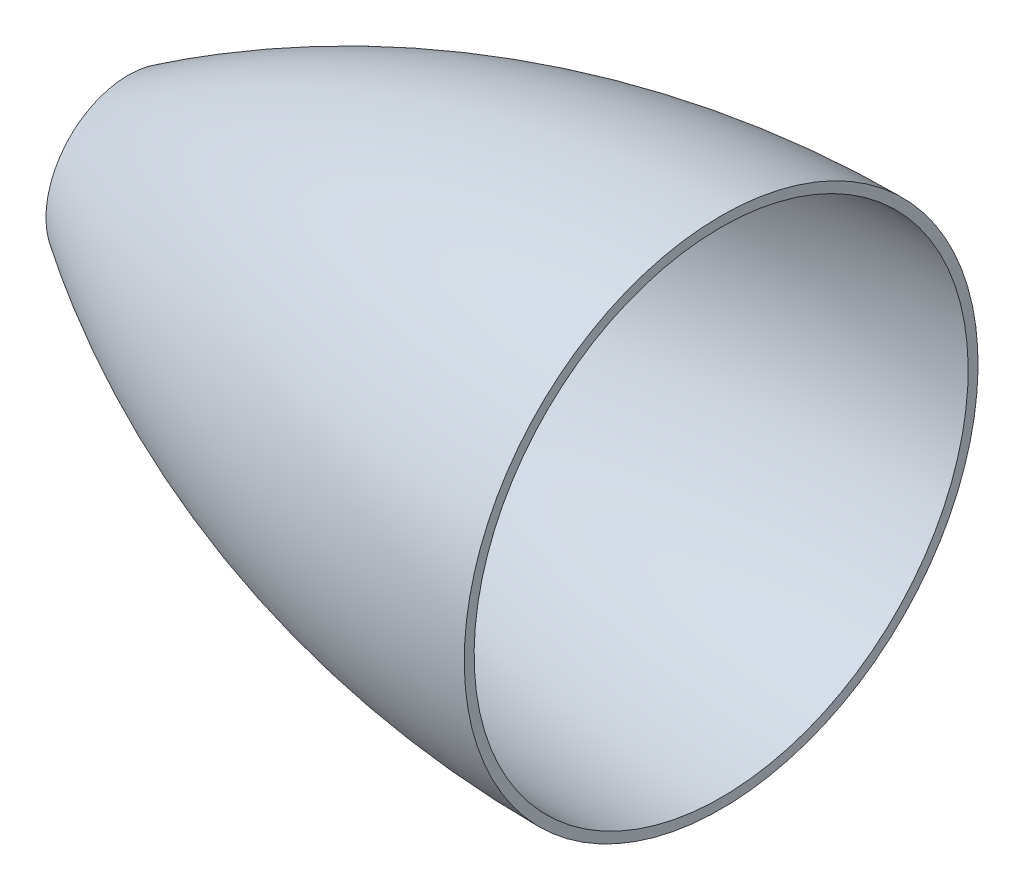
from build123d import *


with BuildPart() as part:
    # Sketch1 → Revolve1 (revolve)
    with BuildSketch(Plane.XY):
        with BuildLine():
            Line((-860.682976555, 78), (-860.682976555, 75))
            ThreePointArc((-860.682976555, 75), (-948.633353859, 63.032442792), (-1030.188361342, 28))
            Line((-1030.188361342, 28), (-992.682976555, 28))
            Line((-992.682976555, 28), (-992.682976555, 0))
            Line((-992.682976555, 0), (-995.682976555, 0))
            Line((-995.682976555, 0), (-995.682976555, 25))
            Line((-995.682976555, 25), (-1040.682976555, 25))
            ThreePointArc((-1040.682976555, 25), (-954.503283525, 64.474627446), (-860.682976555, 78))
        make_face()
    revolve(axis=Axis((-860.682976555, 0, 0), (-1, 0, 0)))


solid = part.part
